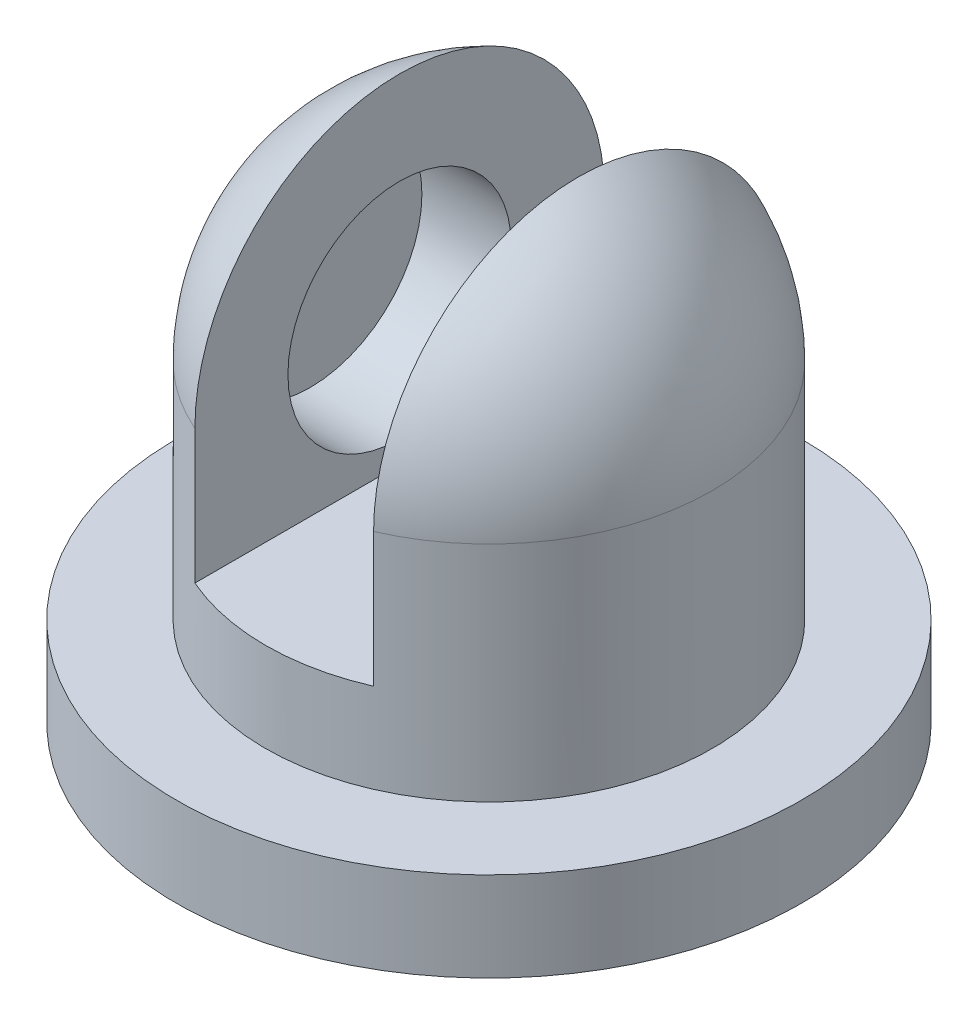
from build123d import *

# Parameters (mm, degrees)
REVOLVE1_ANGLE      = 180
SKETCH2_R           = 5
BOSS_EXTRUDE1_DEPTH = 5
SKETCH3_R           = 7
BOSS_EXTRUDE2_DEPTH = 2
CUT_EXTRUDE1_START  = -3
SKETCH4_W           = 2
SKETCH4_H           = 10
CUT_EXTRUDE1_DEPTH  = 16.124355653
SKETCH6_R           = 2.5
CUT_EXTRUDE2_DEPTH  = 2


with BuildPart() as part:
    # Sketch1 → Revolve1 (revolve)
    with BuildSketch(Plane(origin=(0, 0, 0), x_dir=(1, 0, 0), z_dir=(0, 1, 0))):
        with BuildLine():
            Line((-5, 0), (5, 0))
            ThreePointArc((5, 0), (0, 5), (-5, 0))
        make_face()
    revolve(axis=Axis((-5, 0, 0), (1, 0, 0)), revolution_arc=REVOLVE1_ANGLE)

    # Sketch2 → Boss-Extrude1 (add)
    with BuildSketch(Plane.XZ):
        with Locations(Location((0, 0, 0), (0, 0, 90))):
            Circle(SKETCH2_R)
    extrude(amount=BOSS_EXTRUDE1_DEPTH)

    # Sketch3 → Boss-Extrude2 (add)
    with BuildSketch(Plane.XZ.offset(5)):
        with Locations(Location((0, 0, 0), (0, 0, 270))):
            Circle(SKETCH3_R)
    extrude(amount=BOSS_EXTRUDE2_DEPTH)

    # Sketch4 → Cut-Extrude1 (cut)
    with BuildSketch(Plane(origin=(0, 0, 0), x_dir=(1, 0, 0), z_dir=(0, 1, 0)).offset(CUT_EXTRUDE1_START)):
        with Locations((1, 0)):
            Rectangle(SKETCH4_W, SKETCH4_H)
    cut_extrude1 = extrude(amount=CUT_EXTRUDE1_DEPTH, mode=Mode.SUBTRACT)

    # Sketch6 → Cut-Extrude2 (cut)
    with BuildSketch(Plane.ZY.offset(-2)):
        Circle(SKETCH6_R)
    cut_extrude2 = extrude(amount=-CUT_EXTRUDE2_DEPTH, mode=Mode.SUBTRACT)

    # Mirror1: Cut-Extrude1, Cut-Extrude2 across plane
    add(cut_extrude1.mirror(Plane(origin=(0, 0, 0), x_dir=(0, 0, 1), z_dir=(1, 0, 0))), mode=Mode.SUBTRACT)
    add(cut_extrude2.mirror(Plane(origin=(0, 0, 0), x_dir=(0, 0, 1), z_dir=(1, 0, 0))), mode=Mode.SUBTRACT)


solid = part.part
